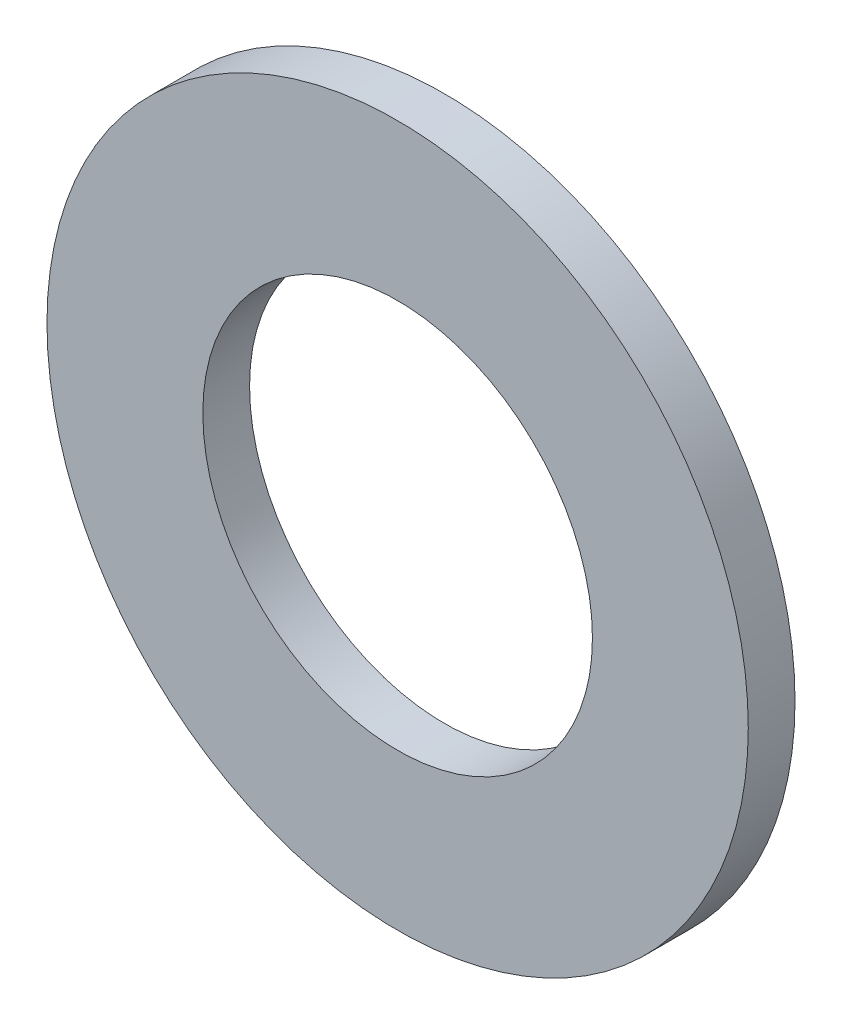
from build123d import *

# Parameters (mm, degrees)
SKETCH1_R           = 22.5
BOSS_EXTRUDE1_DEPTH = 3
SKETCH2_R           = 12.5
CUT_EXTRUDE1_DEPTH  = 3


with BuildPart() as part:
    # Sketch1 → Boss-Extrude1 (new body)
    with BuildSketch(Plane.XY):
        Circle(SKETCH1_R)
    extrude(amount=BOSS_EXTRUDE1_DEPTH)

    # Sketch2 → Cut-Extrude1 (cut)
    with BuildSketch(Plane.XY.offset(3)):
        Circle(SKETCH2_R)
    extrude(amount=-CUT_EXTRUDE1_DEPTH, mode=Mode.SUBTRACT)


solid = part.part
